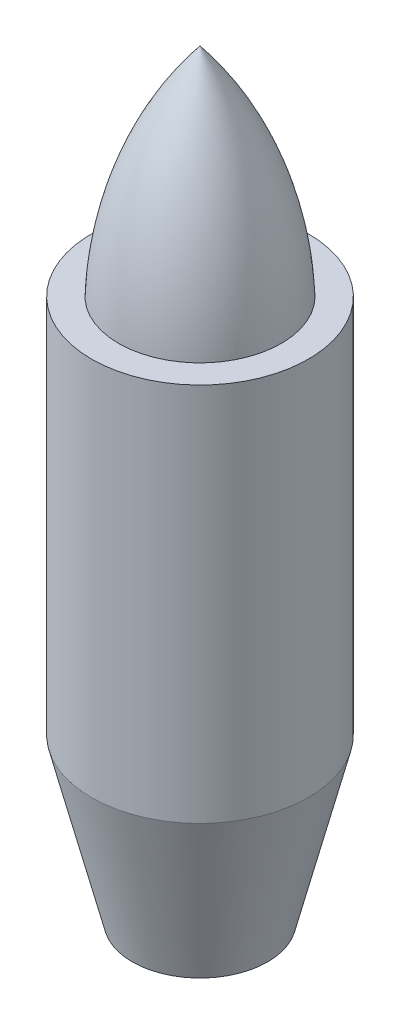
from build123d import *

# Parameters (mm, degrees)
SKETCH1_R           = 200
BOSS_EXTRUDE1_DEPTH = 700
SKETCH2_R           = 125


with BuildPart() as part:
    # Sketch1 → Boss-Extrude1 (new body)
    with BuildSketch(Plane(origin=(0, 0, 0), x_dir=(1, 0, 0), z_dir=(0, 1, 0))):
        with Locations(Location((0, 0, 0), (0, 0, 270))):
            Circle(SKETCH1_R)
    extrude(amount=BOSS_EXTRUDE1_DEPTH)

    # Sketch2 → section 0 of loft1
    with BuildSketch(Plane(origin=(0, -300, 0), x_dir=(-1, 0, 0), z_dir=(0, -1, 0)), mode=Mode.PRIVATE) as loft1_s0:
        Circle(SKETCH2_R)
    # loft up to a face of the part (loft1)
    loft([loft1_s0.sketch, Face(Wire([part.edges().sort_by_distance((-145.793725484, 0, -136.909421186))[0]]))])

    # Sketch3 → Revolve-Thin1 (revolve)
    with BuildSketch(Plane(origin=(0, 0, 0), x_dir=(0, 0, -1), z_dir=(1, 0, 0))):
        with BuildLine():
            ThreePointArc((-150, 700), (-107.313276388, 912.117478645), (0, 1100))
            Line((0, 1100), (0, 700))
            Line((0, 700), (-10, 700))
            Line((-10, 700), (-10, 1070.682765056))
            ThreePointArc((-10, 1070.682765056), (-102.910558319, 894.926882071), (-140.007374323, 699.616031136))
            Line((-140.007374323, 699.616031136), (-150, 700))
        make_face()
    revolve(axis=Axis((0, 1100, 0), (0, -1, 0)))


solid = part.part
